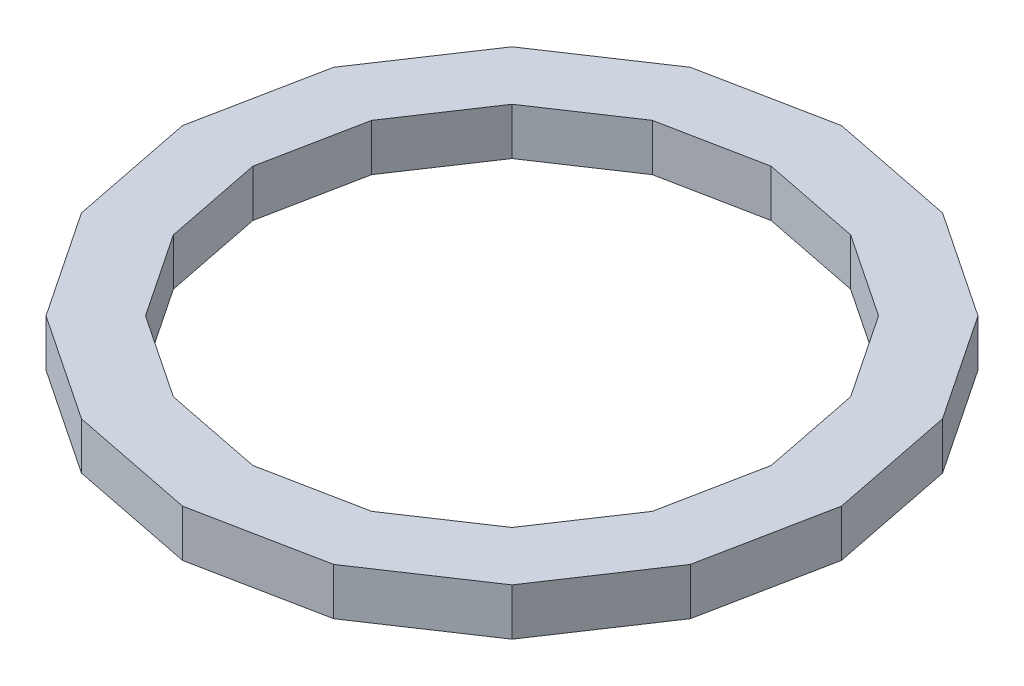
from build123d import *

# Parameters (mm, degrees)
BOSS_EXTRUDE1_DEPTH = 19.05


with BuildPart() as part:
    # Sketch1 → Boss-Extrude1 (new body)
    with BuildSketch(Plane(origin=(0, 0, 0), x_dir=(1, 0, 0), z_dir=(0, 1, 0))):
        Polygon((133.451007364, 0), (123.292654297, 51.069489551), (94.364112263, 94.364112263), (51.069489551, 123.292654297), (0, 133.451007364), (-51.069489551, 123.292654297), (-94.364112263, 94.364112263), (-123.292654297, 51.069489551), (-133.451007364, 0), (-123.292654297, -51.069489551), (-94.364112263, -94.364112263), (-51.069489551, -123.292654297), (0, -133.451007364), (51.069489551, -123.292654297), (94.364112263, -94.364112263), (123.292654297, -51.069489551), align=None)
        Polygon((104.963630404, 0), (96.973749788, 40.167842356), (74.220494836, 74.220494836), (40.167842356, 96.973749788), (0, 104.963630404), (-40.167842356, 96.973749788), (-74.220494836, 74.220494836), (-96.973749788, 40.167842356), (-104.963630404, 0), (-96.973749788, -40.167842356), (-74.220494836, -74.220494836), (-40.167842356, -96.973749788), (0, -104.963630404), (40.167842356, -96.973749788), (74.220494836, -74.220494836), (96.973749788, -40.167842356), align=None, mode=Mode.SUBTRACT)
    extrude(amount=BOSS_EXTRUDE1_DEPTH)


solid = part.part
